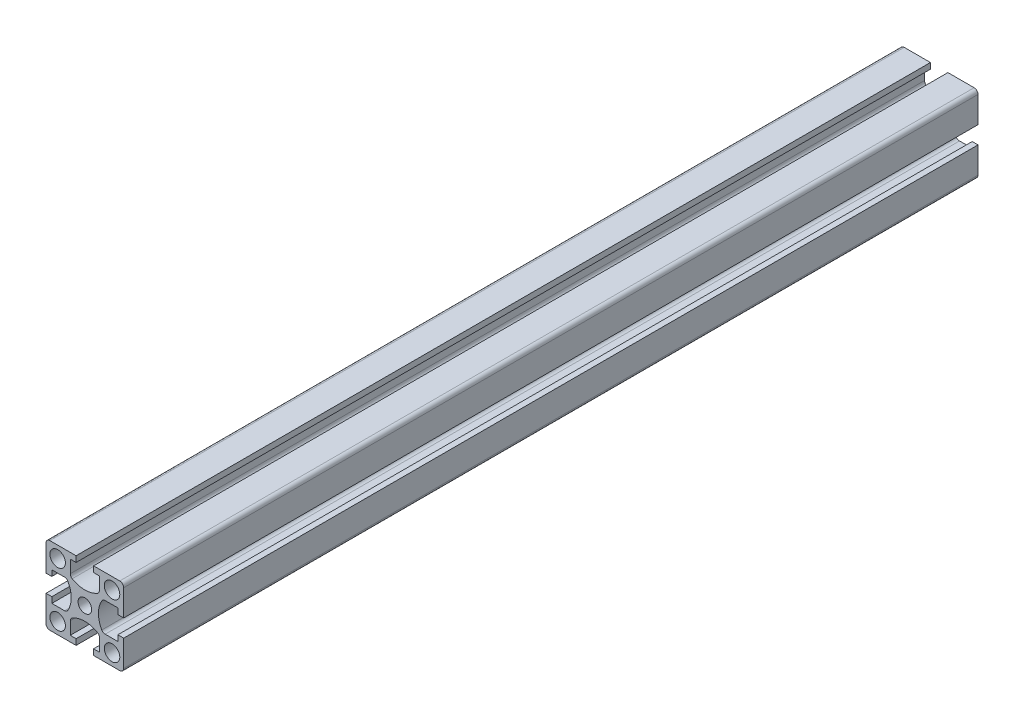
from build123d import *

# Parameters (mm, degrees)
SKETCH1_R           = 2.5
SKETCH1_R_2         = 2.1875
BOSS_EXTRUDE1_DEPTH = 275


with BuildPart() as part:
    # Sketch1 → Boss-Extrude1 (new body)
    with BuildSketch(Plane.XY):
        with BuildLine():
            Line((-12.5, 11.25), (-12.5, 2.8125))
            Line((-12.5, 2.8125), (-10.625, 2.8125))
            Line((-10.625, 2.8125), (-10.625, 4.6875))
            Line((-10.625, 4.6875), (-6.546075349, 4.6875))
            ThreePointArc((-6.546075349, 4.6875), (-5.921075349, 4.520031755), (-5.463543594, 4.0625))
            ThreePointArc((-5.463543594, 4.0625), (-4.375, 0), (-5.463543594, -4.0625))
            ThreePointArc((-5.463543594, -4.0625), (-5.921075349, -4.520031755), (-6.546075349, -4.6875))
            Line((-6.546075349, -4.6875), (-10.625, -4.6875))
            Line((-10.625, -4.6875), (-10.625, -2.8125))
            Line((-10.625, -2.8125), (-12.5, -2.8125))
            Line((-12.5, -2.8125), (-12.5, -11.25))
            ThreePointArc((-12.5, -11.25), (-12.133883476, -12.133883476), (-11.25, -12.5))
            Line((-11.25, -12.5), (-2.8125, -12.5))
            Line((-2.8125, -12.5), (-2.8125, -10.625))
            Line((-2.8125, -10.625), (-4.6875, -10.625))
            Line((-4.6875, -10.625), (-4.6875, -6.546075349))
            ThreePointArc((-4.6875, -6.546075349), (-4.520031755, -5.921075349), (-4.0625, -5.463543594))
            ThreePointArc((-4.0625, -5.463543594), (0, -4.375), (4.0625, -5.463543594))
            ThreePointArc((4.0625, -5.463543594), (4.520031755, -5.921075349), (4.6875, -6.546075349))
            Line((4.6875, -6.546075349), (4.6875, -10.625))
            Line((4.6875, -10.625), (2.8125, -10.625))
            Line((2.8125, -10.625), (2.8125, -12.5))
            Line((2.8125, -12.5), (11.25, -12.5))
            ThreePointArc((11.25, -12.5), (12.133883476, -12.133883476), (12.5, -11.25))
            Line((12.5, -11.25), (12.5, -2.8125))
            Line((12.5, -2.8125), (10.625, -2.8125))
            Line((10.625, -2.8125), (10.625, -4.6875))
            Line((10.625, -4.6875), (6.546075349, -4.6875))
            ThreePointArc((6.546075349, -4.6875), (5.921075349, -4.520031755), (5.463543594, -4.0625))
            ThreePointArc((5.463543594, -4.0625), (4.375, 0), (5.463543594, 4.0625))
            ThreePointArc((5.463543594, 4.0625), (5.921075349, 4.520031755), (6.546075349, 4.6875))
            Line((6.546075349, 4.6875), (10.625, 4.6875))
            Line((10.625, 4.6875), (10.625, 2.8125))
            Line((10.625, 2.8125), (12.5, 2.8125))
            Line((12.5, 2.8125), (12.5, 11.25))
            ThreePointArc((12.5, 11.25), (12.133883476, 12.133883476), (11.25, 12.5))
            Line((11.25, 12.5), (2.8125, 12.5))
            Line((2.8125, 12.5), (2.8125, 10.625))
            Line((2.8125, 10.625), (4.6875, 10.625))
            Line((4.6875, 10.625), (4.6875, 6.546075349))
            ThreePointArc((4.6875, 6.546075349), (4.520031755, 5.921075349), (4.0625, 5.463543594))
            ThreePointArc((4.0625, 5.463543594), (0, 4.375), (-4.0625, 5.463543594))
            ThreePointArc((-4.0625, 5.463543594), (-4.520031755, 5.921075349), (-4.6875, 6.546075349))
            Line((-4.6875, 6.546075349), (-4.6875, 10.625))
            Line((-4.6875, 10.625), (-2.8125, 10.625))
            Line((-2.8125, 10.625), (-2.8125, 12.5))
            Line((-2.8125, 12.5), (-11.25, 12.5))
            ThreePointArc((-11.25, 12.5), (-12.133883476, 12.133883476), (-12.5, 11.25))
        make_face()
        with Locations((-8.75, -8.75)):
            Circle(SKETCH1_R, mode=Mode.SUBTRACT)
        with Locations((8.75, -8.75)):
            Circle(SKETCH1_R, mode=Mode.SUBTRACT)
        with Locations((8.75, 8.75)):
            Circle(SKETCH1_R, mode=Mode.SUBTRACT)
        Circle(SKETCH1_R_2, mode=Mode.SUBTRACT)
        with Locations((-8.75, 8.75)):
            Circle(SKETCH1_R, mode=Mode.SUBTRACT)
    extrude(amount=BOSS_EXTRUDE1_DEPTH)


solid = part.part
